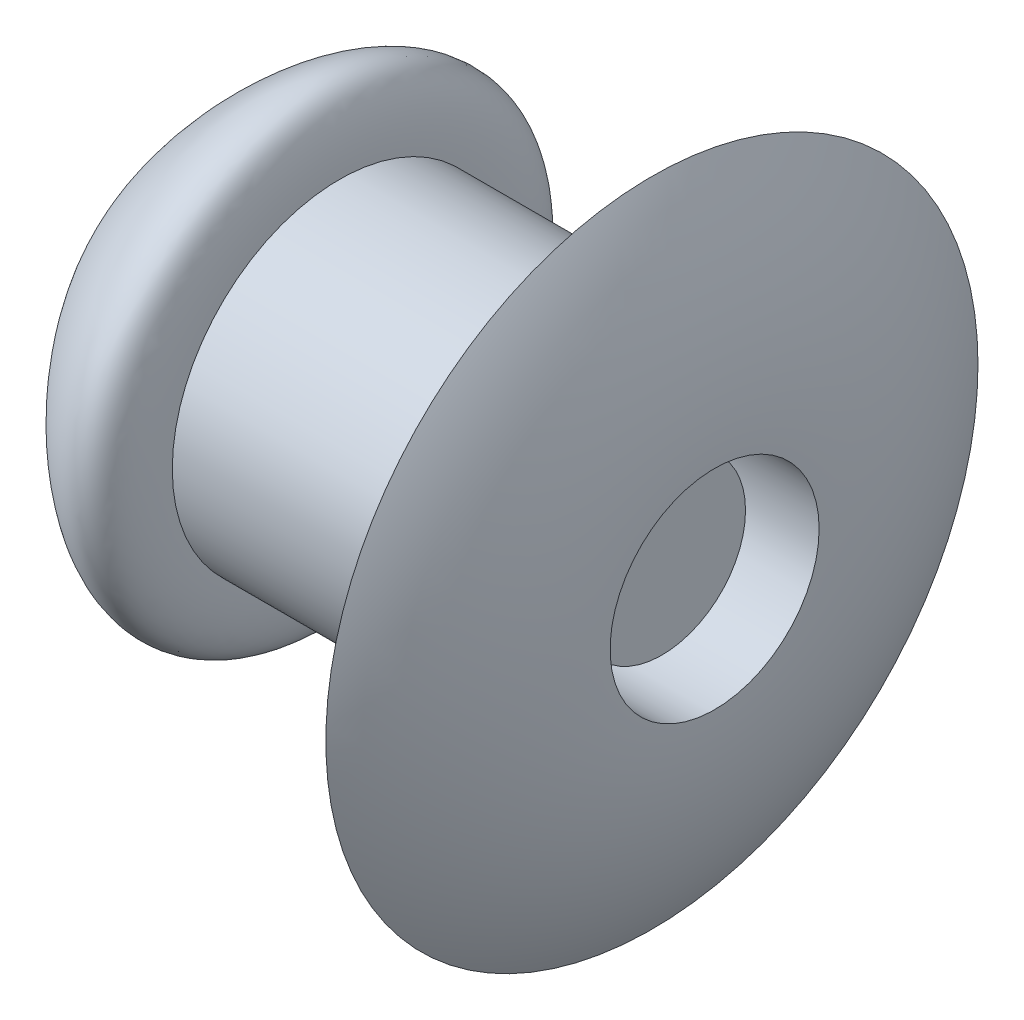
from build123d import *


with BuildPart() as part:
    # Szkic1 → Obrót1 (revolve)
    with BuildSketch(Plane.XY, mode=Mode.PRIVATE) as obr_t1_sk:
        with BuildLine():
            Line((350.856147885, 893.681551629), (345.4, 893.681551629))
            add(Edge.make_bspline(
                [(346.055380649, 894.856511413), (345.173909168, 894.872028365), (345.4, 893.681551629)],
                knots=[0, 0, 0, 1, 1, 1], degree=2))
            add(Edge.make_bspline(
                [(347.000000014, 895.681551629), (347.036555424, 898.021351685), (343.536594652, 893.309377005), (345.758684651, 895.170148194), (346.055380649, 894.856511413)],
                knots=[0, 0, 0, 0, 0.744501965, 1, 1, 1, 1], degree=3))
            Line((347.000000014, 895.681551629), (350.7366, 895.681551629))
            Line((350.7366, 895.681551629), (350.7366, 897.581551629))
            ThreePointArc((350.7366, 897.581551629), (351.295488572, 896.308595565), (351.4866, 894.931551629))
            Line((351.4866, 894.931551629), (347, 894.931551629))
            Line((347, 894.931551629), (347, 894.681551629))
            Line((347, 894.681551629), (350.856147885, 894.681551629))
            Line((350.856147885, 894.681551629), (350.856147885, 893.681551629))
        make_face()
    revolve(obr_t1_sk.sketch.rotate(Axis((350.856147885, 893.681551629, 0), (-1, 0, 0)), 90), axis=Axis((350.856147885, 893.681551629, 0), (-1, 0, 0)))


solid = part.part
